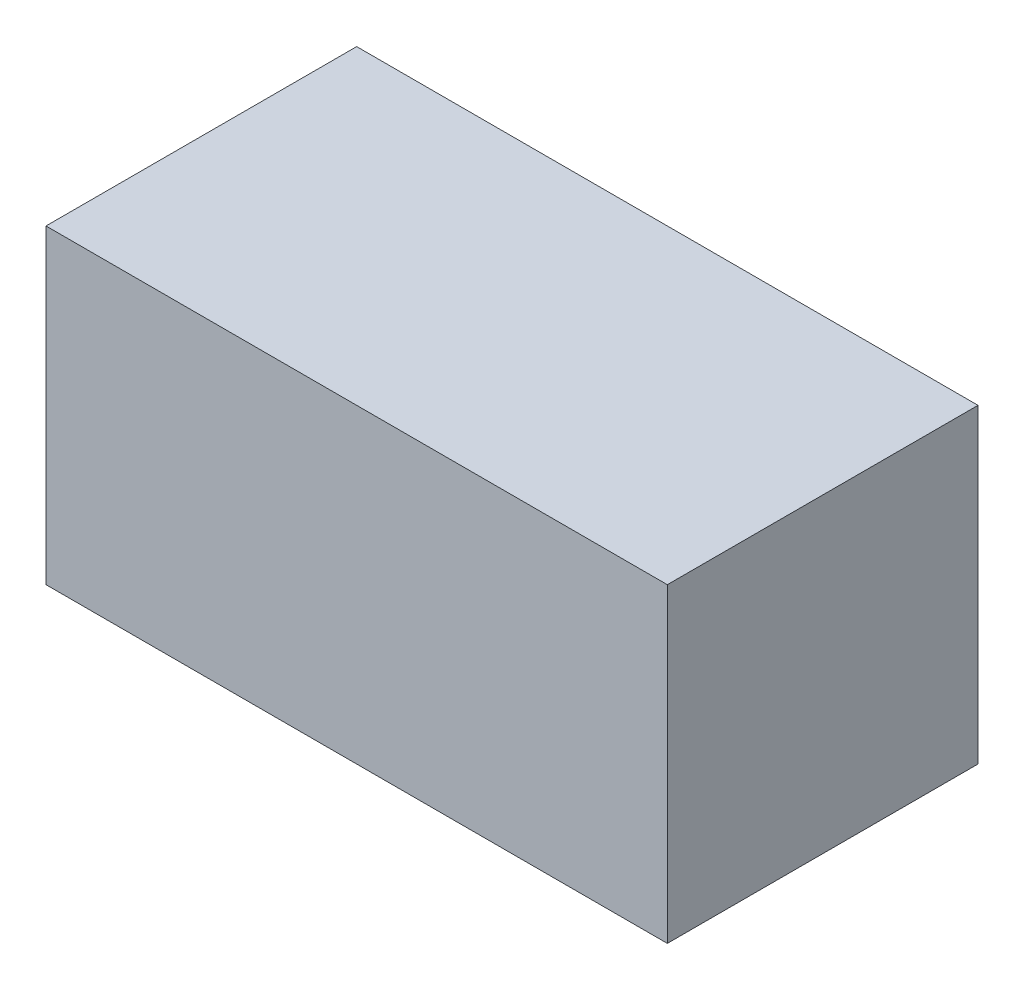
from build123d import *

# Parameters (mm, degrees)
SKETCH1_W           = 25.4
SKETCH1_H           = 12.7
SKETCH1_W_2         = 12.7
SKETCH1_H_2         = 6.35
BOSS_EXTRUDE1_DEPTH = 12.7
SKETCH2_W           = 12.7
SKETCH2_H           = 6.35
BOSS_EXTRUDE2_DEPTH = 6.35


with BuildPart() as part:
    # Sketch1 → Boss-Extrude1 (new body)
    with BuildSketch(Plane.XY):
        with Locations((-12.7, 6.35)):
            Rectangle(SKETCH1_W, SKETCH1_H)
        with Locations((-12.7, 6.35)):
            Rectangle(SKETCH1_W_2, SKETCH1_H_2, mode=Mode.SUBTRACT)
    extrude(amount=BOSS_EXTRUDE1_DEPTH)

    # Sketch2 → Boss-Extrude2 (add)
    with BuildSketch(Plane.XY.offset(12.7)):
        with Locations((-12.7, 6.35)):
            Rectangle(SKETCH2_W, SKETCH2_H)
    extrude(amount=-BOSS_EXTRUDE2_DEPTH)


solid = part.part
